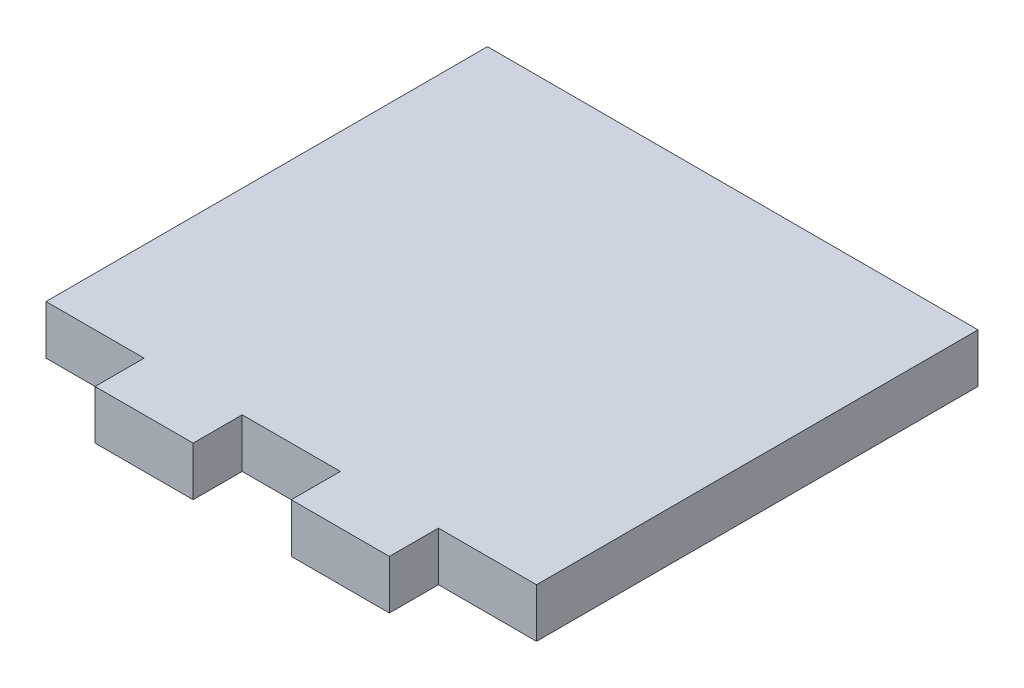
from build123d import *

# Parameters (mm, degrees)
SKETCH1_W           = 100
SKETCH1_H           = 100
BOSS_EXTRUDE1_DEPTH = 10
SKETCH2_W           = 20
SKETCH2_H           = 10
CUT_EXTRUDE1_DEPTH  = 10


with BuildPart() as part:
    # Sketch1 → Boss-Extrude1 (new body)
    with BuildSketch(Plane(origin=(0, 0, 0), x_dir=(1, 0, 0), z_dir=(0, 1, 0))):
        Rectangle(SKETCH1_W, SKETCH1_H)
    extrude(amount=BOSS_EXTRUDE1_DEPTH)

    # Sketch2 → Cut-Extrude1 (cut)
    with BuildSketch(Plane(origin=(0, 10, 0), x_dir=(1, 0, 0), z_dir=(0, 1, 0))):
        with Locations((-40, -45)):
            Rectangle(SKETCH2_W, SKETCH2_H)
        with Locations((0, -45)):
            Rectangle(SKETCH2_W, SKETCH2_H)
        with Locations((40, -45)):
            Rectangle(SKETCH2_W, SKETCH2_H)
    extrude(amount=-CUT_EXTRUDE1_DEPTH, mode=Mode.SUBTRACT)


solid = part.part
